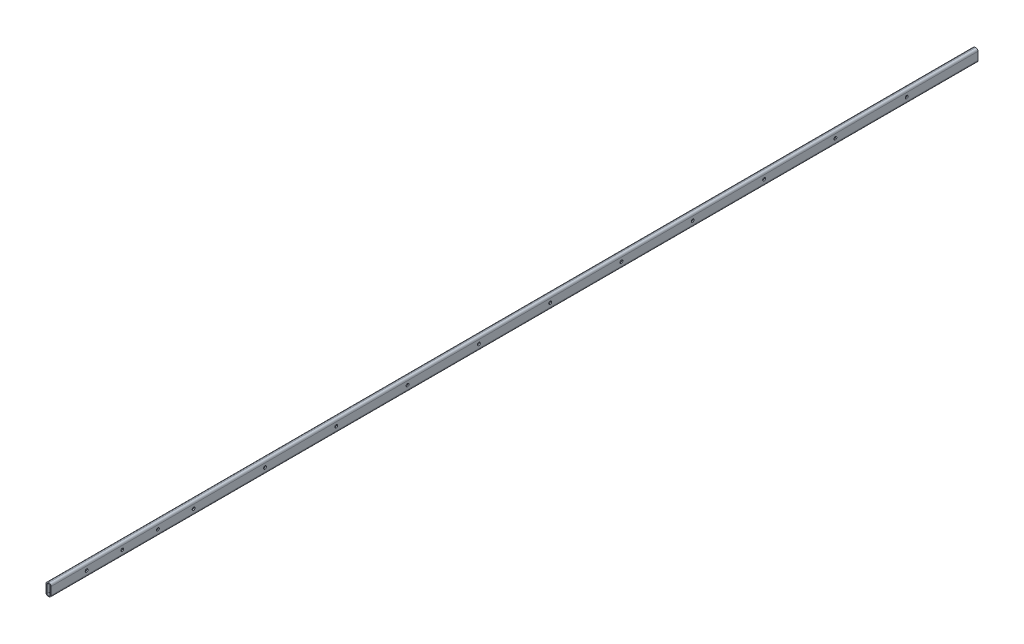
from build123d import *

# Parameters (mm, degrees)
EXTRUDE_1_DEPTH     = 1300
SKETCH_3_R          = 2
CUT_EXTRUDE_1_DEPTH = 1301.046633779
CUT_EXTRUDE_2_DEPTH = 1500
SKETCH_5_R          = 2
CUT_EXTRUDE_3_DEPTH = 1301.046633779


with BuildPart() as part:
    # 草图2 → 凸台-拉伸1 (new body)
    with BuildSketch(Plane.XY):
        with BuildLine():
            Line((-0.5, 8.5), (0.5, 8.5))
            ThreePointArc((0.5, 8.5), (2.621320344, 7.621320344), (3.5, 5.5))
            Line((3.5, 5.5), (3.5, -5.5))
            ThreePointArc((3.5, -5.5), (2.621320344, -7.621320344), (0.5, -8.5))
            Line((0.5, -8.5), (-0.5, -8.5))
            ThreePointArc((-0.5, -8.5), (-2.621320344, -7.621320344), (-3.5, -5.5))
            Line((-3.5, -5.5), (-3.5, 5.5))
            ThreePointArc((-3.5, 5.5), (-2.621320344, 7.621320344), (-0.5, 8.5))
        make_face()
    extrude(amount=EXTRUDE_1_DEPTH)

    # 草图3 → 切除-拉伸1 (cut, through all)
    with BuildSketch(Plane.ZY.offset(3.5)):
        with Locations((100, 0)):
            Circle(SKETCH_3_R)
        with Locations((200, 0)):
            Circle(SKETCH_3_R)
        with Locations((300, 0)):
            Circle(SKETCH_3_R)
        with Locations((400, 0)):
            Circle(SKETCH_3_R)
        with Locations((500, 0)):
            Circle(SKETCH_3_R)
        with Locations((600, 0)):
            Circle(SKETCH_3_R)
        with Locations((700, 0)):
            Circle(SKETCH_3_R)
        with Locations((800, 0)):
            Circle(SKETCH_3_R)
        with Locations((900, 0)):
            Circle(SKETCH_3_R)
        with Locations((1000, 0)):
            Circle(SKETCH_3_R)
    extrude(amount=-CUT_EXTRUDE_1_DEPTH, mode=Mode.SUBTRACT)

    # 草图4 → 切除-拉伸2 (cut)
    with BuildSketch(Plane(origin=(0, 0, 0), x_dir=(-1, 0, 0), z_dir=(0, 0, -1))):
        with BuildLine():
            Line((-0.5, 7), (0.5, 7))
            ThreePointArc((0.5, 7), (1.560660172, 6.560660172), (2, 5.5))
            Line((2, 5.5), (2, -5.90279402))
            ThreePointArc((2, -5.90279402), (1.678635809, -6.678635809), (0.90279402, -7))
            Line((0.90279402, -7), (-0.90279402, -7))
            ThreePointArc((-0.90279402, -7), (-1.678635809, -6.678635809), (-2, -5.90279402))
            Line((-2, -5.90279402), (-2, 5.5))
            ThreePointArc((-2, 5.5), (-1.560660172, 6.560660172), (-0.5, 7))
        make_face()
    extrude(amount=-CUT_EXTRUDE_2_DEPTH, mode=Mode.SUBTRACT)

    # 草图5 → 切除-拉伸3 (cut, through all)
    with BuildSketch(Plane.ZY.offset(3.5)):
        with Locations((1100, 0)):
            Circle(SKETCH_5_R)
        with Locations((1200, 0)):
            Circle(SKETCH_5_R)
        with Locations((1250, 0)):
            Circle(SKETCH_5_R)
        with Locations((1150, 0)):
            Circle(SKETCH_5_R)
    extrude(amount=-CUT_EXTRUDE_3_DEPTH, mode=Mode.SUBTRACT)


solid = part.part
